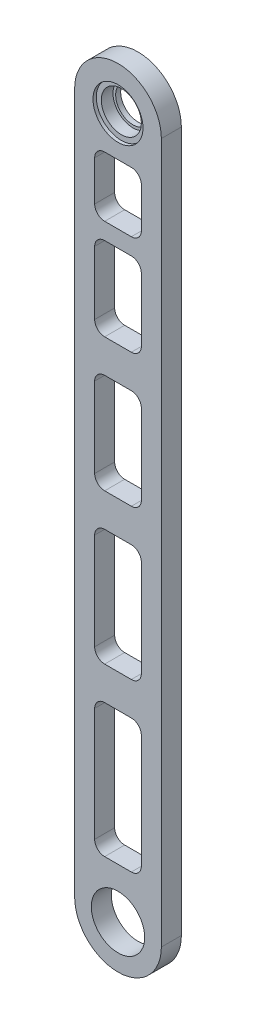
from build123d import *

# Parameters (mm, degrees)
SKETCH_1_R          = 8
EXTRUDE_1_DEPTH     = 6
SKETCH_2_W          = 14
SKETCH_2_H          = 25
SKETCH_2_H_2        = 30
SKETCH_2_H_3        = 35
SKETCH_2_H_4        = 40
SKETCH_2_H_5        = 18
CUT_EXTRUDE_1_DEPTH = 224.45916853
FILLET_1_R          = 3
SKETCH_3_R          = 8
SKETCH_3_R_2        = 5.2
EXTRUDE_2_DEPTH     = 6
SKETCH_4_R          = 6
CUT_EXTRUDE_2_DEPTH = 4.5
SKETCH_5_R          = 7.5
CUT_EXTRUDE_3_DEPTH = 1


with BuildPart() as part:
    # 草图1 → 凸台-拉伸1 (new body)
    with BuildSketch(Plane.XY):
        with BuildLine():
            Line((-13, 0), (-13, 210))
            ThreePointArc((-13, 210), (0, 223), (13, 210))
            Line((13, 210), (13, 0))
            ThreePointArc((13, 0), (0, -13), (-13, 0))
        make_face()
        Circle(SKETCH_1_R, mode=Mode.SUBTRACT)
        with Locations((0, 210)):
            Circle(SKETCH_1_R, mode=Mode.SUBTRACT)
    extrude(amount=EXTRUDE_1_DEPTH)

    # 草图2 → 切除-拉伸1 (cut, through all)
    with BuildSketch(Plane.XY.offset(6)):
        with Locations((0, 162.5)):
            Rectangle(SKETCH_2_W, SKETCH_2_H)
        with Locations((0, 125)):
            Rectangle(SKETCH_2_W, SKETCH_2_H_2)
        with Locations((0, 82.5)):
            Rectangle(SKETCH_2_W, SKETCH_2_H_3)
        with Locations((0, 35)):
            Rectangle(SKETCH_2_W, SKETCH_2_H_4)
        with Locations((0, 189)):
            Rectangle(SKETCH_2_W, SKETCH_2_H_5)
    extrude(amount=-CUT_EXTRUDE_1_DEPTH, mode=Mode.SUBTRACT)

    # 圆角1
    fillet_1_edges = [part.edges().sort_by_distance(p)[0] for p in [
        (7, 140, 3),
        (7, 110, 3),
        (-7, 110, 3),
        (-7, 140, 3),
        (7, 100, 3),
        (7, 65, 3),
        (-7, 65, 3),
        (-7, 100, 3),
        (7, 55, 3),
        (7, 15, 3),
        (-7, 15, 3),
        (-7, 55, 3),
        (7, 198, 3),
        (7, 180, 3),
        (-7, 180, 3),
        (-7, 198, 3),
        (7, 175, 3),
        (7, 150, 3),
        (-7, 150, 3),
        (-7, 175, 3),
    ]]
    fillet(fillet_1_edges, radius=FILLET_1_R)

    # 草图3 → 凸台-拉伸2 (add)
    with BuildSketch(Plane(origin=(0, 0, 0), x_dir=(-1, 0, 0), z_dir=(0, 0, -1))):
        with Locations((0, 210)):
            Circle(SKETCH_3_R)
        with Locations((0, 210)):
            Circle(SKETCH_3_R_2, mode=Mode.SUBTRACT)
    extrude(amount=-EXTRUDE_2_DEPTH)

    # 草图4 → 切除-拉伸2 (cut)
    with BuildSketch(Plane.XY.offset(6)):
        with Locations((0, 210)):
            Circle(SKETCH_4_R)
    extrude(amount=-CUT_EXTRUDE_2_DEPTH, mode=Mode.SUBTRACT)

    # 草图5 → 切除-拉伸3 (cut)
    with BuildSketch(Plane.XY.offset(6)):
        with Locations((0, 210)):
            Circle(SKETCH_5_R)
    extrude(amount=-CUT_EXTRUDE_3_DEPTH, mode=Mode.SUBTRACT)


solid = part.part
